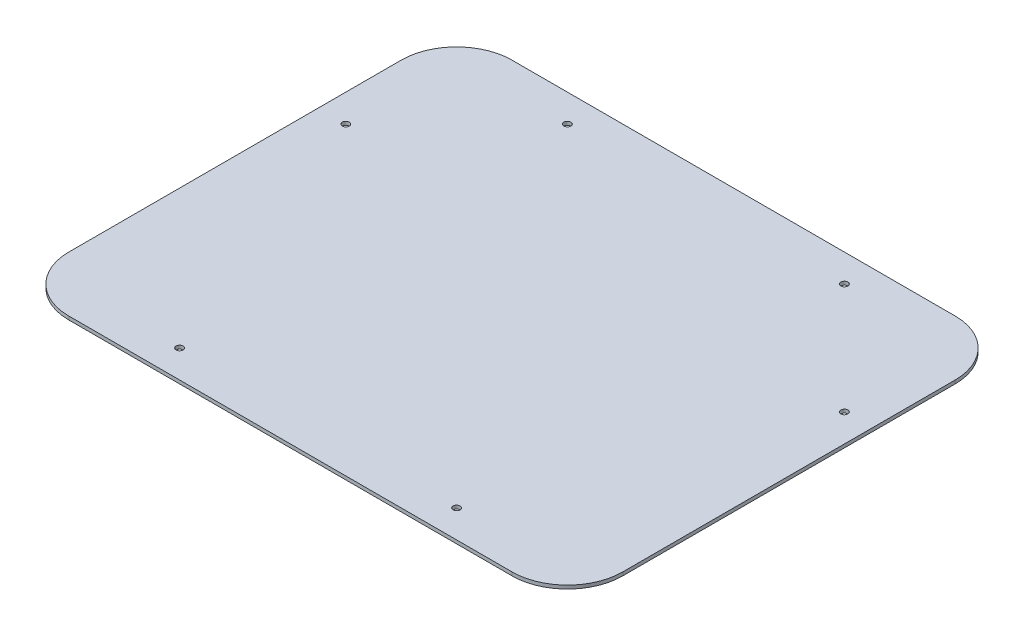
from build123d import *

# Parameters (mm, degrees)
SKETCH1_W                       = 508
SKETCH1_H                       = 406.4
BOSS_EXTRUDE1_DEPTH             = 3.175
FILLET1_R                       = 50.8
F_1_4_0_25_DIAMETER_HOLE1_D     = 6.35
F_1_4_0_25_DIAMETER_HOLE1_DEPTH = 25.4
F_1_4_0_25_DIAMETER_HOLE1_TIP   = 1.907732465


with BuildPart() as part:
    # Sketch1 → Boss-Extrude1 (new body)
    with BuildSketch(Plane(origin=(0, 0, 0), x_dir=(1, 0, 0), z_dir=(0, 1, 0))):
        Rectangle(SKETCH1_W, SKETCH1_H)
    extrude(amount=BOSS_EXTRUDE1_DEPTH)

    # Fillet1
    fillet1_edges = [part.edges().sort_by_distance(p)[0] for p in [
        (-254, 1.5875, -203.2),
        (254, 1.5875, -203.2),
        (254, 1.5875, 203.2),
        (-254, 1.5875, 203.2),
    ]]
    fillet(fillet1_edges, radius=FILLET1_R)

    # 1/4 (0.25) Diameter Hole1
    with Locations(Plane(origin=(0, 3.175, 0), x_dir=(-1, 0, 0), z_dir=(0, 1, 0))):
        with Locations((228.6, -76.2), (127, -177.8), (-127, -177.8), (-228.6, -76.2), (-127, 177.8), (127, 177.8)):
            Hole(F_1_4_0_25_DIAMETER_HOLE1_D / 2, depth=F_1_4_0_25_DIAMETER_HOLE1_DEPTH)
            with Locations((0, 0, -(F_1_4_0_25_DIAMETER_HOLE1_DEPTH + F_1_4_0_25_DIAMETER_HOLE1_TIP / 2))):  # 118° drill point
                Cone(0, F_1_4_0_25_DIAMETER_HOLE1_D / 2, F_1_4_0_25_DIAMETER_HOLE1_TIP, mode=Mode.SUBTRACT)


solid = part.part
